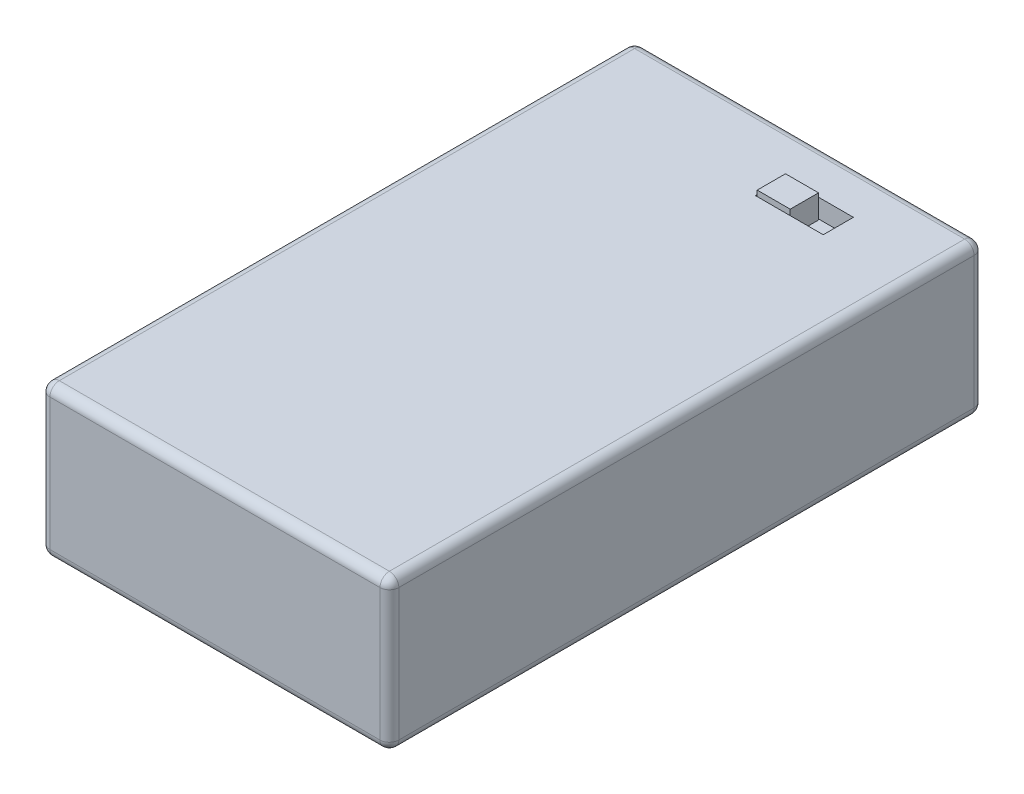
from build123d import *

# Parameters (mm, degrees)
SKETCH_1_W          = 37
SKETCH_1_H          = 63
EXTRUDE_1_DEPTH     = 16
FILLET_1_R          = 1
CUT_EXTRUDE_START   = 16
SKETCH_1_9_W        = 7.2
SKETCH_1_9_H        = 3.2
CUT_EXTRUDE_1_DEPTH = 2
EXTRUDE_START       = 14
SKETCH_1_10_W       = 3.5
SKETCH_1_10_H       = 3
EXTRUDE_2_DEPTH     = 2.5
SKETCH_2_R          = 2.5
CUT_EXTRUDE_2_DEPTH = 2


with BuildPart() as part:
    # 草图1 → 凸台-拉伸1 (new body)
    with BuildSketch(Plane(origin=(0, 0, 0), x_dir=(1, 0, 0), z_dir=(0, 1, 0))):
        Rectangle(SKETCH_1_W, SKETCH_1_H)
    extrude(amount=EXTRUDE_1_DEPTH)

    # 圆角1
    fillet_1_edges = [part.edges().sort_by_distance(p)[0] for p in [
        (0, 16, -31.5),
        (-18.5, 16, 0),
        (0, 16, 31.5),
        (-18.5, 0, 0),
        (0, 0, -31.5),
        (18.5, 0, 0),
        (0, 0, 31.5),
        (-18.5, 8, 31.5),
        (-18.5, 8, -31.5),
        (18.5, 8, -31.5),
        (18.5, 8, 31.5),
        (18.5, 16, 0),
    ]]
    fillet(fillet_1_edges, radius=FILLET_1_R)

    # 草图1<9> → 切除-拉伸1 (cut)
    with BuildSketch(Plane(origin=(0, 0, 0), x_dir=(1, 0, 0), z_dir=(0, 1, 0)).offset(CUT_EXTRUDE_START)):
        with Locations((6, 25)):
            Rectangle(SKETCH_1_9_W, SKETCH_1_9_H)
    extrude(amount=-CUT_EXTRUDE_1_DEPTH, mode=Mode.SUBTRACT)

    # 草图1<10> → 凸台-拉伸2 (add)
    with BuildSketch(Plane(origin=(0, 0, 0), x_dir=(1, 0, 0), z_dir=(0, 1, 0)).offset(EXTRUDE_START)):
        with Locations((4.25, 25)):
            Rectangle(SKETCH_1_10_W, SKETCH_1_10_H)
    extrude(amount=EXTRUDE_2_DEPTH)

    # 草图2 → 切除-拉伸2 (cut)
    with BuildSketch(Plane(origin=(0, 0, -31.5), x_dir=(-1, 0, 0), z_dir=(0, 0, -1))):
        with Locations((11.5, 11)):
            Circle(SKETCH_2_R)
    extrude(amount=-CUT_EXTRUDE_2_DEPTH, mode=Mode.SUBTRACT)


solid = part.part
